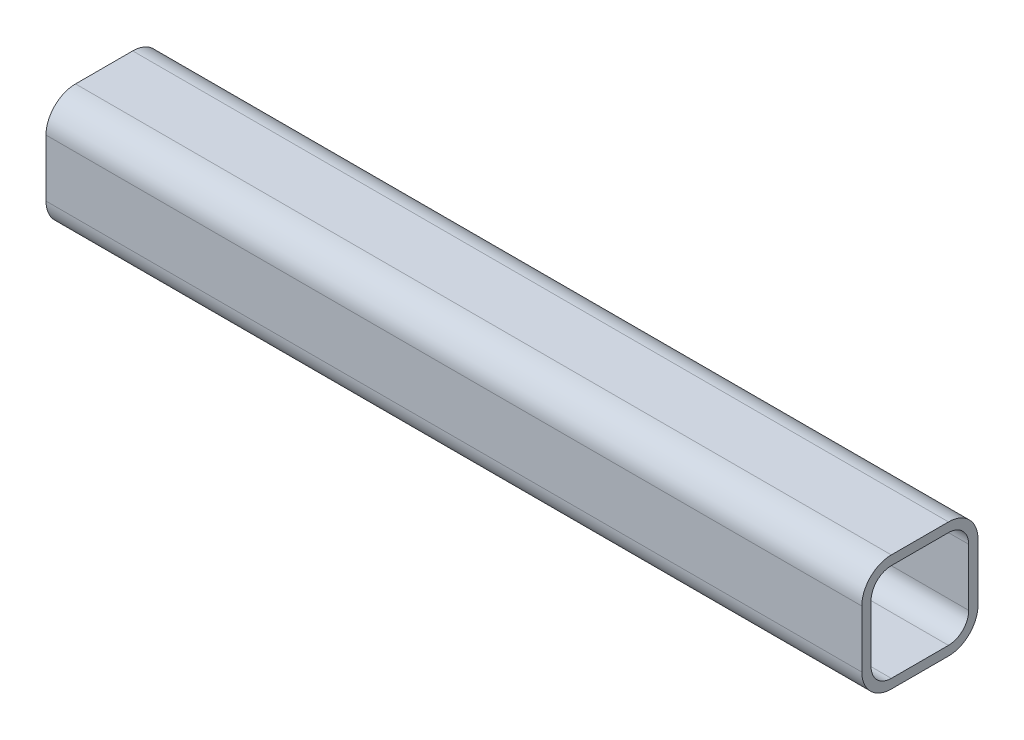
from build123d import *

# Parameters (mm, degrees)
MIEMBRO_ESTRUCTURAL1_DEPTH = 351


with BuildPart() as part:
    # Sketch1 → Miembro estructural1 (new body)
    with BuildSketch(Plane.YZ.offset(-178.308765334)):
        with BuildLine():
            Line((-12.3, -25), (12.3, -25))
            ThreePointArc((12.3, -25), (21.280256121, -21.280256121), (25, -12.3))
            Line((25, -12.3), (25, 12.3))
            ThreePointArc((25, 12.3), (21.280256121, 21.280256121), (12.3, 25))
            Line((12.3, 25), (-12.3, 25))
            ThreePointArc((-12.3, 25), (-21.280256121, 21.280256121), (-25, 12.3))
            Line((-25, 12.3), (-25, -12.3))
            ThreePointArc((-25, -12.3), (-21.280256121, -21.280256121), (-12.3, -25))
        make_face()
        with BuildLine():
            Line((-12.3, -21), (12.3, -21))
            ThreePointArc((12.3, -21), (18.451828996, -18.451828996), (21, -12.3))
            Line((21, -12.3), (21, 12.3))
            ThreePointArc((21, 12.3), (18.451828996, 18.451828996), (12.3, 21))
            Line((12.3, 21), (-12.3, 21))
            ThreePointArc((-12.3, 21), (-18.451828996, 18.451828996), (-21, 12.3))
            Line((-21, 12.3), (-21, -12.3))
            ThreePointArc((-21, -12.3), (-18.451828996, -18.451828996), (-12.3, -21))
        make_face(mode=Mode.SUBTRACT)
    extrude(amount=MIEMBRO_ESTRUCTURAL1_DEPTH)


solid = part.part
